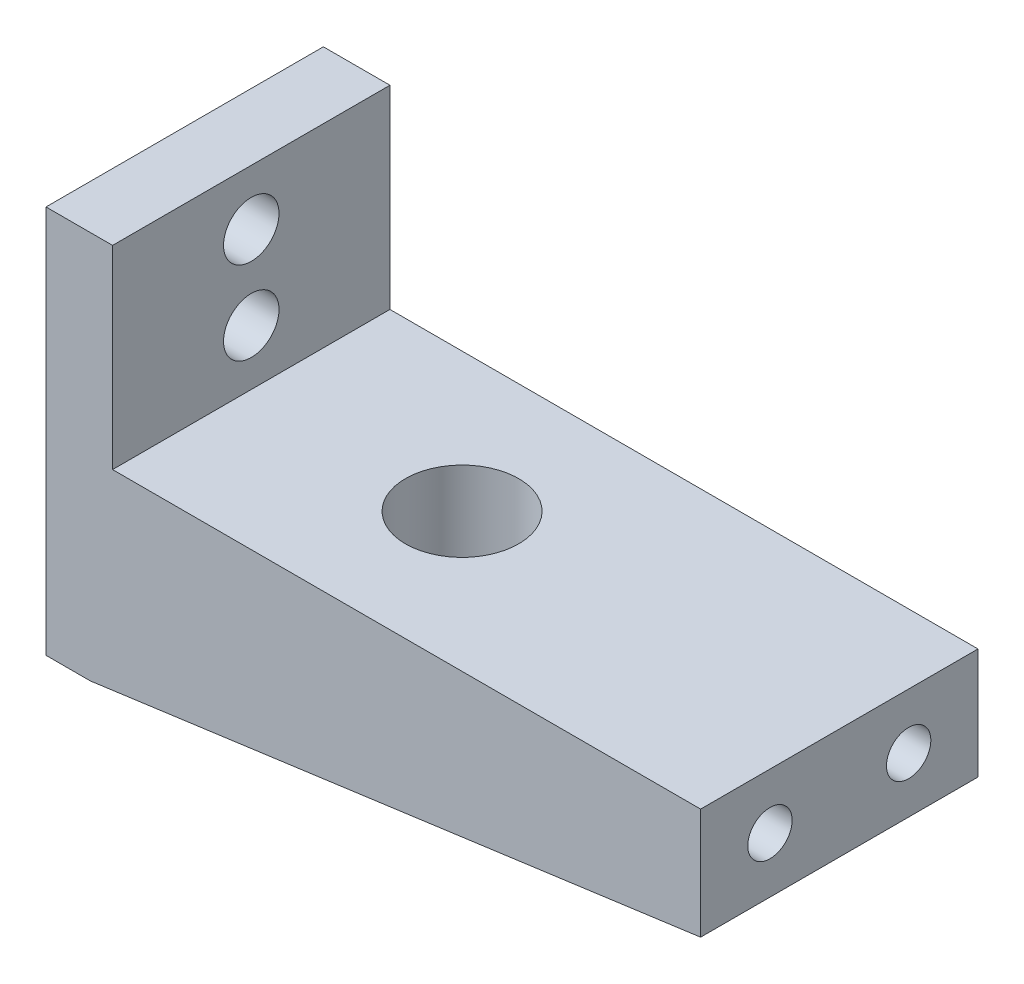
from build123d import *

# Parameters (mm, degrees)
CROQUIS3_W              = 25
CROQUIS3_H              = 35
SALIENTE_EXTRUIR2_DEPTH = 4
CROQUIS5_W              = 25
CROQUIS5_H              = 17.5
SALIENTE_EXTRUIR3_DEPTH = 2
CROQUIS7_W              = 25
CROQUIS7_H              = 10
SALIENTE_EXTRUIR5_DEPTH = 55
CROQUIS8_R              = 2.5
CORTAR_EXTRUIR1_DEPTH   = 55
SALIENTE_EXTRUIR6_DEPTH = 25
CROQUIS9_R              = 5.1
CORTAR_EXTRUIR3_DEPTH   = 4
CROQUIS11_R             = 2
CORTAR_EXTRUIR4_DEPTH   = 20
CROQUIS12_R             = 5.1
CORTAR_EXTRUIR5_DEPTH   = 45


with BuildPart() as part:
    # Croquis3 → Saliente-Extruir2 (new body)
    with BuildSketch(Plane(origin=(0, 0, 0), x_dir=(0, 0, -1), z_dir=(1, 0, 0))):
        with Locations((4.326923077, 2.8125)):
            Rectangle(CROQUIS3_W, CROQUIS3_H)
    extrude(amount=SALIENTE_EXTRUIR2_DEPTH)

    # Croquis5 → Saliente-Extruir3 (add)
    with BuildSketch(Plane(origin=(4, 0, 0), x_dir=(0, 0, -1), z_dir=(1, 0, 0))):
        with Locations((4.326923077, 11.5625)):
            Rectangle(CROQUIS5_W, CROQUIS5_H)
    extrude(amount=SALIENTE_EXTRUIR3_DEPTH)

    # Croquis7 → Saliente-Extruir5 (add)
    with BuildSketch(Plane(origin=(4, 0, 0), x_dir=(0, 0, -1), z_dir=(1, 0, 0))):
        with Locations((4.326923077, -2.1875)):
            Rectangle(CROQUIS7_W, CROQUIS7_H)
    extrude(amount=SALIENTE_EXTRUIR5_DEPTH)

    # Croquis8 → Cortar-Extruir1 (cut)
    with BuildSketch(Plane(origin=(6, 0, 0), x_dir=(0, 0, -1), z_dir=(1, 0, 0))):
        with Locations((4.326923077, 15.3125)):
            Circle(CROQUIS8_R)
        with Locations((4.326923077, 7.8125)):
            Circle(CROQUIS8_R)
    extrude(amount=-CORTAR_EXTRUIR1_DEPTH, mode=Mode.SUBTRACT)

    # Croquis10 → Saliente-Extruir6 (add, through all)
    with BuildSketch(Plane.XY.offset(8.173076923)):
        Polygon((4, -14.6875), (59, -7.1875), (4, -7.1875), align=None)
    extrude(amount=-SALIENTE_EXTRUIR6_DEPTH)

    # Croquis9 → Cortar-Extruir3 (cut)
    with BuildSketch(Plane(origin=(0, 2.8125, 0), x_dir=(1, 0, 0), z_dir=(0, 1, 0))):
        with Locations(Location((25, 4.326923077, 0), (0, 0, 270))):
            Circle(CROQUIS9_R)
    extrude(amount=-CORTAR_EXTRUIR3_DEPTH, mode=Mode.SUBTRACT)

    # Croquis11 → Cortar-Extruir4 (cut)
    with BuildSketch(Plane(origin=(59, 0, 0), x_dir=(0, 0, -1), z_dir=(1, 0, 0))):
        with Locations((-1.923076923, -2.1875)):
            Circle(CROQUIS11_R)
        with Locations((10.576923077, -2.1875)):
            Circle(CROQUIS11_R)
    extrude(amount=-CORTAR_EXTRUIR4_DEPTH, mode=Mode.SUBTRACT)

    # Croquis12 → Cortar-Extruir5 (cut)
    with BuildSketch(Plane(origin=(0, -1.1875, 0), x_dir=(1, 0, 0), z_dir=(0, 1, 0))):
        with Locations(Location((25, 4.326923077, 0), (0, 0, 270))):
            Circle(CROQUIS12_R)
    extrude(amount=-CORTAR_EXTRUIR5_DEPTH, mode=Mode.SUBTRACT)


solid = part.part
